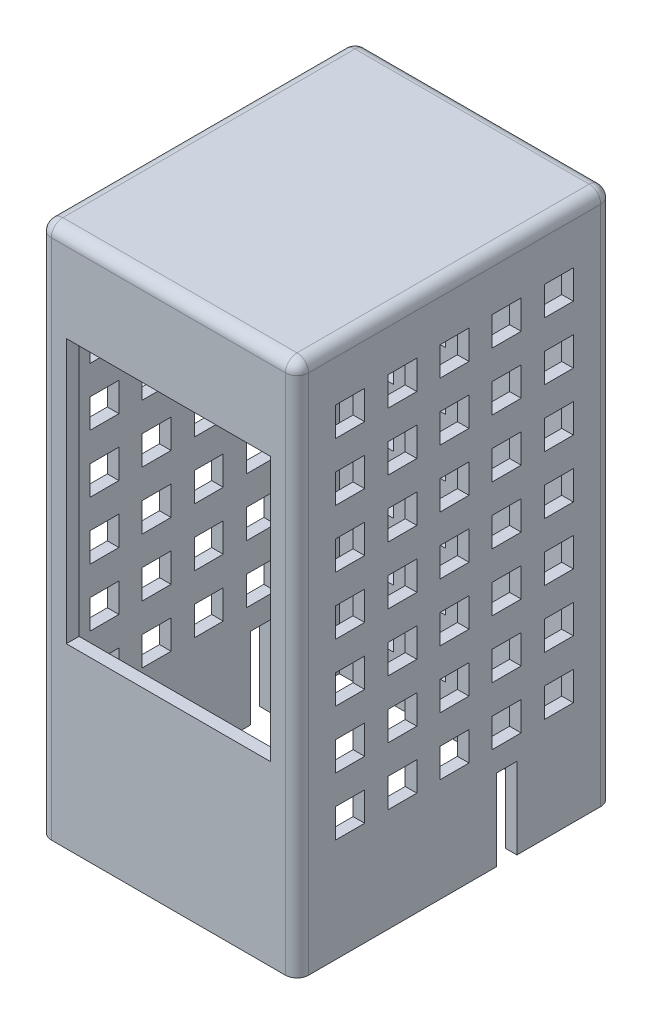
from build123d import *

# Parameters (mm, degrees)
SKETCH_1_W           = 44.4
SKETCH_1_H           = 54.4
SKETCH_1_W_2         = 40.4
SKETCH_1_H_2         = 45
EXTRUDE_2_DEPTH      = 92
CUT_EXTRUDE_1_REACH  = 111.161
SKETCH_2_W           = 35.20744465
SKETCH_2_H           = 45.609644206
SKETCH_3_W           = 40.2
SKETCH_3_H           = 56.7
CUT_EXTRUDE_2_DEPTH  = 2.5
SKETCH_10_W          = 5
SKETCH_10_H          = 5
CUT_EXTRUDE_13_DEPTH = 106.712818523
SKETCH_11_W          = 5
SKETCH_11_H          = 5
CUT_EXTRUDE_14_DEPTH = 4.7
SKETCH_12_W          = 44.4
SKETCH_12_H          = 54.4
EXTRUDE_3_DEPTH      = 2.5
SKETCH_13_W          = 44.4
SKETCH_13_H          = 3.522667035
CUT_EXTRUDE_15_DEPTH = 14
FILLET_1_R           = 2


with BuildPart() as part:
    # 草图1 → 凸台-拉伸2 (new body)
    with BuildSketch(Plane(origin=(0, 0, 0), x_dir=(1, 0, 0), z_dir=(0, 1, 0))):
        Rectangle(SKETCH_1_W, SKETCH_1_H)
        Rectangle(SKETCH_1_W_2, SKETCH_1_H_2, mode=Mode.SUBTRACT)
    extrude(amount=EXTRUDE_2_DEPTH)

    # 草图2 → 切除-拉伸1 (cut, up to next)
    with BuildSketch(Plane.XY.offset(27.2), mode=Mode.PRIVATE) as cut_extrude_1_sk1:
        with Locations((0, 53.436048251)):
            Rectangle(SKETCH_2_W, SKETCH_2_H)
    cut_extrude_1_tool1 = extrude(cut_extrude_1_sk1.sketch, amount=-CUT_EXTRUDE_1_REACH, mode=Mode.PRIVATE) & part.part
    add(cut_extrude_1_tool1.solids().sort_by_distance((0, 53.436048, 27.2))[0], mode=Mode.SUBTRACT)

    # 草图3 → 切除-拉伸2 (cut)
    with BuildSketch(Plane(origin=(0, 0, 22.5), x_dir=(-1, 0, 0), z_dir=(0, 0, -1))):
        with Locations((0, 54.061762465)):
            Rectangle(SKETCH_3_W, SKETCH_3_H)
    extrude(amount=-CUT_EXTRUDE_2_DEPTH, mode=Mode.SUBTRACT)

    # 草图10 → 切除-拉伸13 (cut, through all)
    with BuildSketch(Plane.ZY.offset(22.2)):
        with Locations((9.029388044, 20.372995261)):
            Rectangle(SKETCH_10_W, SKETCH_10_H)
        with Locations((0.029388044, 20.372995261)):
            Rectangle(SKETCH_10_W, SKETCH_10_H)
        with Locations((-8.970611956, 20.372995261)):
            Rectangle(SKETCH_10_W, SKETCH_10_H)
        with Locations((-17.970611956, 20.372995261)):
            Rectangle(SKETCH_10_W, SKETCH_10_H)
        with Locations((9.029388044, 30.372995261)):
            Rectangle(SKETCH_10_W, SKETCH_10_H)
        with Locations((0.029388044, 30.372995261)):
            Rectangle(SKETCH_10_W, SKETCH_10_H)
        with Locations((-8.970611956, 30.372995261)):
            Rectangle(SKETCH_10_W, SKETCH_10_H)
        with Locations((-17.970611956, 30.372995261)):
            Rectangle(SKETCH_10_W, SKETCH_10_H)
        with Locations((9.029388044, 40.372995261)):
            Rectangle(SKETCH_10_W, SKETCH_10_H)
        with Locations((0.029388044, 40.372995261)):
            Rectangle(SKETCH_10_W, SKETCH_10_H)
        with Locations((-8.970611956, 40.372995261)):
            Rectangle(SKETCH_10_W, SKETCH_10_H)
        with Locations((-17.970611956, 40.372995261)):
            Rectangle(SKETCH_10_W, SKETCH_10_H)
        with Locations((9.029388044, 50.372995261)):
            Rectangle(SKETCH_10_W, SKETCH_10_H)
        with Locations((0.029388044, 50.372995261)):
            Rectangle(SKETCH_10_W, SKETCH_10_H)
        with Locations((-8.970611956, 50.372995261)):
            Rectangle(SKETCH_10_W, SKETCH_10_H)
        with Locations((-17.970611956, 50.372995261)):
            Rectangle(SKETCH_10_W, SKETCH_10_H)
        with Locations((9.029388044, 60.372995261)):
            Rectangle(SKETCH_10_W, SKETCH_10_H)
        with Locations((0.029388044, 60.372995261)):
            Rectangle(SKETCH_10_W, SKETCH_10_H)
        with Locations((-8.970611956, 60.372995261)):
            Rectangle(SKETCH_10_W, SKETCH_10_H)
        with Locations((-17.970611956, 60.372995261)):
            Rectangle(SKETCH_10_W, SKETCH_10_H)
        with Locations((9.029388044, 70.372995261)):
            Rectangle(SKETCH_10_W, SKETCH_10_H)
        with Locations((0.029388044, 70.372995261)):
            Rectangle(SKETCH_10_W, SKETCH_10_H)
        with Locations((-8.970611956, 70.372995261)):
            Rectangle(SKETCH_10_W, SKETCH_10_H)
        with Locations((-17.970611956, 70.372995261)):
            Rectangle(SKETCH_10_W, SKETCH_10_H)
        with Locations((9.029388044, 80.372995261)):
            Rectangle(SKETCH_10_W, SKETCH_10_H)
        with Locations((0.029388044, 80.372995261)):
            Rectangle(SKETCH_10_W, SKETCH_10_H)
        with Locations((-8.970611956, 80.372995261)):
            Rectangle(SKETCH_10_W, SKETCH_10_H)
        with Locations((-17.970611956, 80.372995261)):
            Rectangle(SKETCH_10_W, SKETCH_10_H)
        with Locations((18.029388044, 20.372995261)):
            Rectangle(SKETCH_10_W, SKETCH_10_H)
        with Locations((18.029388044, 30.372995261)):
            Rectangle(SKETCH_10_W, SKETCH_10_H)
        with Locations((18.029388044, 40.372995261)):
            Rectangle(SKETCH_10_W, SKETCH_10_H)
        with Locations((18.029388044, 50.372995261)):
            Rectangle(SKETCH_10_W, SKETCH_10_H)
        with Locations((18.029388044, 60.372995261)):
            Rectangle(SKETCH_10_W, SKETCH_10_H)
        with Locations((18.029388044, 70.372995261)):
            Rectangle(SKETCH_10_W, SKETCH_10_H)
        with Locations((18.029388044, 80.372995261)):
            Rectangle(SKETCH_10_W, SKETCH_10_H)
    extrude(amount=-CUT_EXTRUDE_13_DEPTH, mode=Mode.SUBTRACT)

    # 草图11 → 切除-拉伸14 (cut)
    with BuildSketch(Plane(origin=(0, 0, -27.2), x_dir=(-1, 0, 0), z_dir=(0, 0, -1))):
        with Locations((13.37876365, 10.397386655)):
            Rectangle(SKETCH_11_W, SKETCH_11_H)
        with Locations((4.37876365, 10.397386655)):
            Rectangle(SKETCH_11_W, SKETCH_11_H)
        with Locations((-4.62123635, 10.397386655)):
            Rectangle(SKETCH_11_W, SKETCH_11_H)
        with Locations((-13.62123635, 10.397386655)):
            Rectangle(SKETCH_11_W, SKETCH_11_H)
        with Locations((13.37876365, 20.397386655)):
            Rectangle(SKETCH_11_W, SKETCH_11_H)
        with Locations((4.37876365, 20.397386655)):
            Rectangle(SKETCH_11_W, SKETCH_11_H)
        with Locations((-4.62123635, 20.397386655)):
            Rectangle(SKETCH_11_W, SKETCH_11_H)
        with Locations((-13.62123635, 20.397386655)):
            Rectangle(SKETCH_11_W, SKETCH_11_H)
        with Locations((13.37876365, 30.397386655)):
            Rectangle(SKETCH_11_W, SKETCH_11_H)
        with Locations((4.37876365, 30.397386655)):
            Rectangle(SKETCH_11_W, SKETCH_11_H)
        with Locations((-4.62123635, 30.397386655)):
            Rectangle(SKETCH_11_W, SKETCH_11_H)
        with Locations((-13.62123635, 30.397386655)):
            Rectangle(SKETCH_11_W, SKETCH_11_H)
        with Locations((13.37876365, 40.397386655)):
            Rectangle(SKETCH_11_W, SKETCH_11_H)
        with Locations((4.37876365, 40.397386655)):
            Rectangle(SKETCH_11_W, SKETCH_11_H)
        with Locations((-4.62123635, 40.397386655)):
            Rectangle(SKETCH_11_W, SKETCH_11_H)
        with Locations((-13.62123635, 40.397386655)):
            Rectangle(SKETCH_11_W, SKETCH_11_H)
        with Locations((13.37876365, 50.397386655)):
            Rectangle(SKETCH_11_W, SKETCH_11_H)
        with Locations((4.37876365, 50.397386655)):
            Rectangle(SKETCH_11_W, SKETCH_11_H)
        with Locations((-4.62123635, 50.397386655)):
            Rectangle(SKETCH_11_W, SKETCH_11_H)
        with Locations((-13.62123635, 50.397386655)):
            Rectangle(SKETCH_11_W, SKETCH_11_H)
        with Locations((13.37876365, 60.397386655)):
            Rectangle(SKETCH_11_W, SKETCH_11_H)
        with Locations((4.37876365, 60.397386655)):
            Rectangle(SKETCH_11_W, SKETCH_11_H)
        with Locations((-4.62123635, 60.397386655)):
            Rectangle(SKETCH_11_W, SKETCH_11_H)
        with Locations((-13.62123635, 60.397386655)):
            Rectangle(SKETCH_11_W, SKETCH_11_H)
        with Locations((13.37876365, 70.397386655)):
            Rectangle(SKETCH_11_W, SKETCH_11_H)
        with Locations((4.37876365, 70.397386655)):
            Rectangle(SKETCH_11_W, SKETCH_11_H)
        with Locations((-4.62123635, 70.397386655)):
            Rectangle(SKETCH_11_W, SKETCH_11_H)
        with Locations((-13.62123635, 70.397386655)):
            Rectangle(SKETCH_11_W, SKETCH_11_H)
        with Locations((13.37876365, 80.397386655)):
            Rectangle(SKETCH_11_W, SKETCH_11_H)
        with Locations((4.37876365, 80.397386655)):
            Rectangle(SKETCH_11_W, SKETCH_11_H)
        with Locations((-4.62123635, 80.397386655)):
            Rectangle(SKETCH_11_W, SKETCH_11_H)
        with Locations((-13.62123635, 80.397386655)):
            Rectangle(SKETCH_11_W, SKETCH_11_H)
    extrude(amount=-CUT_EXTRUDE_14_DEPTH, mode=Mode.SUBTRACT)

    # 草图12 → 凸台-拉伸3 (add)
    with BuildSketch(Plane(origin=(0, 92, 0), x_dir=(1, 0, 0), z_dir=(0, 1, 0))):
        Rectangle(SKETCH_12_W, SKETCH_12_H)
    extrude(amount=-EXTRUDE_3_DEPTH)

    # 草图13 → 切除-拉伸15 (cut)
    with BuildSketch(Plane.XZ):
        with Locations((0, -8.977490248)):
            Rectangle(SKETCH_13_W, SKETCH_13_H)
    extrude(amount=-CUT_EXTRUDE_15_DEPTH, mode=Mode.SUBTRACT)

    # 圆角1
    fillet_1_edges = [part.edges().sort_by_distance(p)[0] for p in [
        (22.2, 92, 0),
        (0, 92, 27.2),
        (-22.2, 92, 0),
        (0, 92, -27.2),
        (-22.2, 46, 27.2),
        (22.2, 46, 27.2),
        (22.2, 46, -27.2),
        (-22.2, 46, -27.2),
    ]]
    fillet(fillet_1_edges, radius=FILLET_1_R)


solid = part.part
